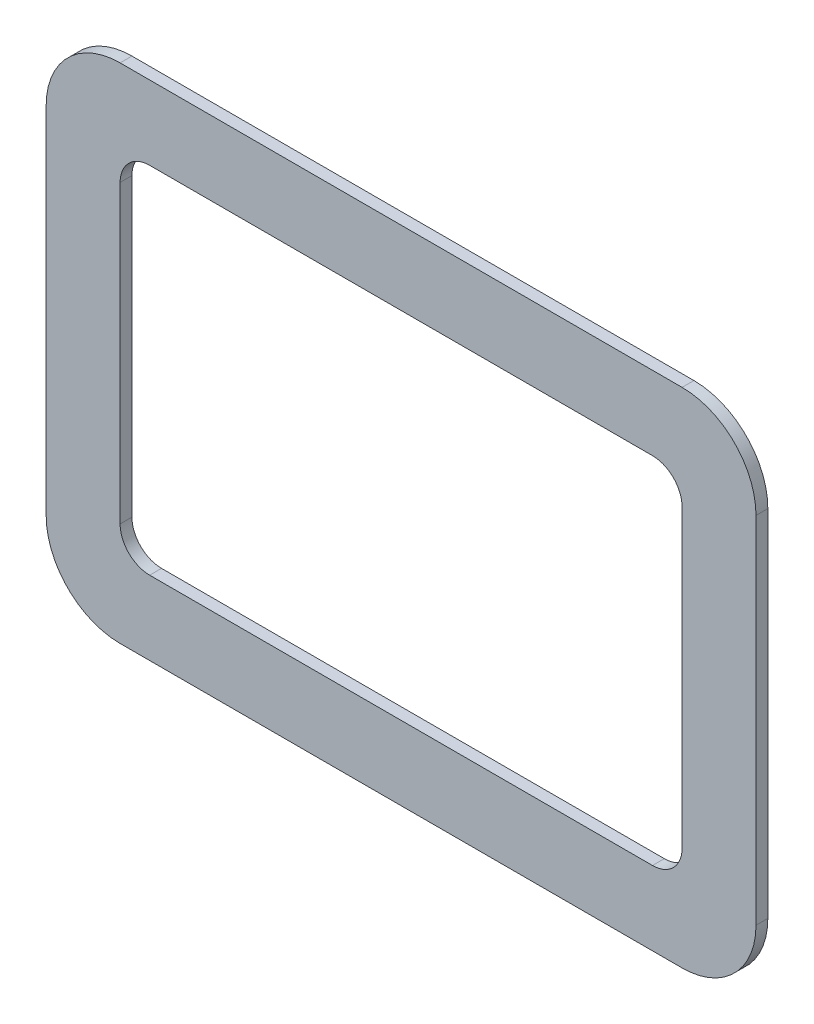
from build123d import *

# Parameters (mm, degrees)
EXTRUDE_1_DEPTH = 0.8


with BuildPart() as part:
    # Эскиз1 → Бобышка-Вытянуть1 (new body)
    with BuildSketch(Plane.XY):
        with BuildLine():
            Line((-19, 17), (19, 17))
            ThreePointArc((19, 17), (22.535533906, 15.535533906), (24, 12))
            Line((24, 12), (24, -12))
            ThreePointArc((24, -12), (22.535533906, -15.535533906), (19, -17))
            Line((19, -17), (-19, -17))
            ThreePointArc((-19, -17), (-22.535533906, -15.535533906), (-24, -12))
            Line((-24, -12), (-24, 12))
            ThreePointArc((-24, 12), (-22.535533906, 15.535533906), (-19, 17))
        make_face()
        with BuildLine():
            Line((-17, 12), (17, 12))
            ThreePointArc((17, 12), (18.414213562, 11.414213562), (19, 10))
            Line((19, 10), (19, -10))
            ThreePointArc((19, -10), (18.414213562, -11.414213562), (17, -12))
            Line((17, -12), (-17, -12))
            ThreePointArc((-17, -12), (-18.414213562, -11.414213562), (-19, -10))
            Line((-19, -10), (-19, 10))
            ThreePointArc((-19, 10), (-18.414213562, 11.414213562), (-17, 12))
        make_face(mode=Mode.SUBTRACT)
    extrude(amount=EXTRUDE_1_DEPTH)


solid = part.part
